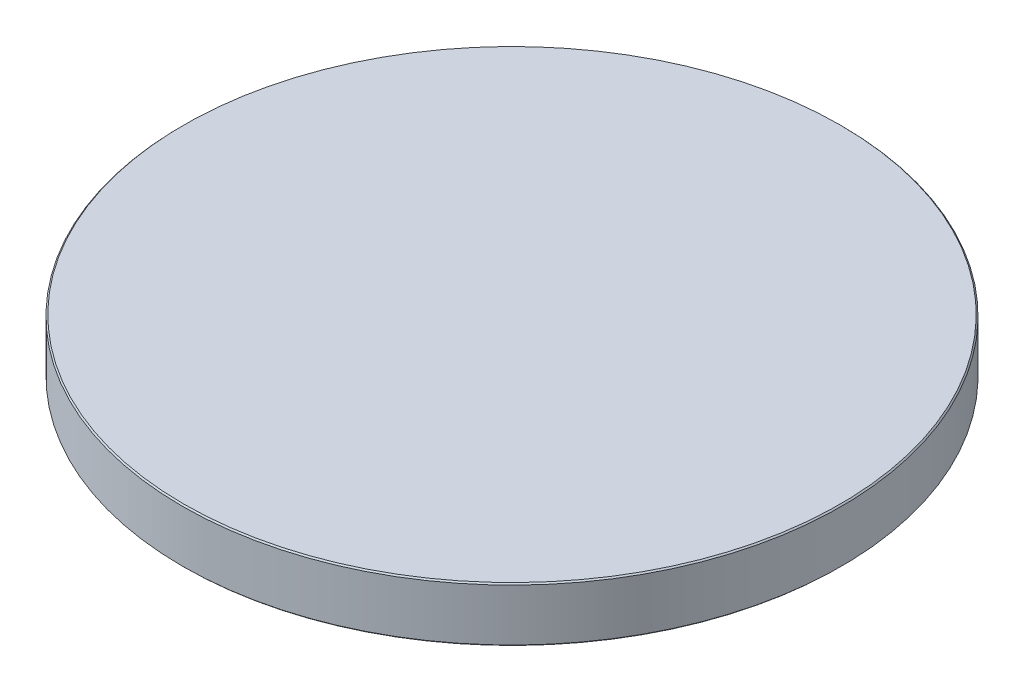
from build123d import *

# Parameters (mm, degrees)
SKETCH1_R           = 12.7
BOSS_EXTRUDE1_DEPTH = 2.1
CHAMFER1_SIZE       = 0.05


with BuildPart() as part:
    # Sketch1 → Boss-Extrude1 (new body)
    with BuildSketch(Plane(origin=(0, 0, 0), x_dir=(1, 0, 0), z_dir=(0, 1, 0))):
        with Locations(Location((0, 0, 0), (0, 0, 270))):
            Circle(SKETCH1_R)
    extrude(amount=BOSS_EXTRUDE1_DEPTH)

    # Chamfer1
    chamfer1_edges = [part.edges().sort_by_distance(p)[0] for p in [
        (0, 0, -12.7),
        (0, 2.1, -12.7),
    ]]
    chamfer(chamfer1_edges, length=CHAMFER1_SIZE)


solid = part.part
